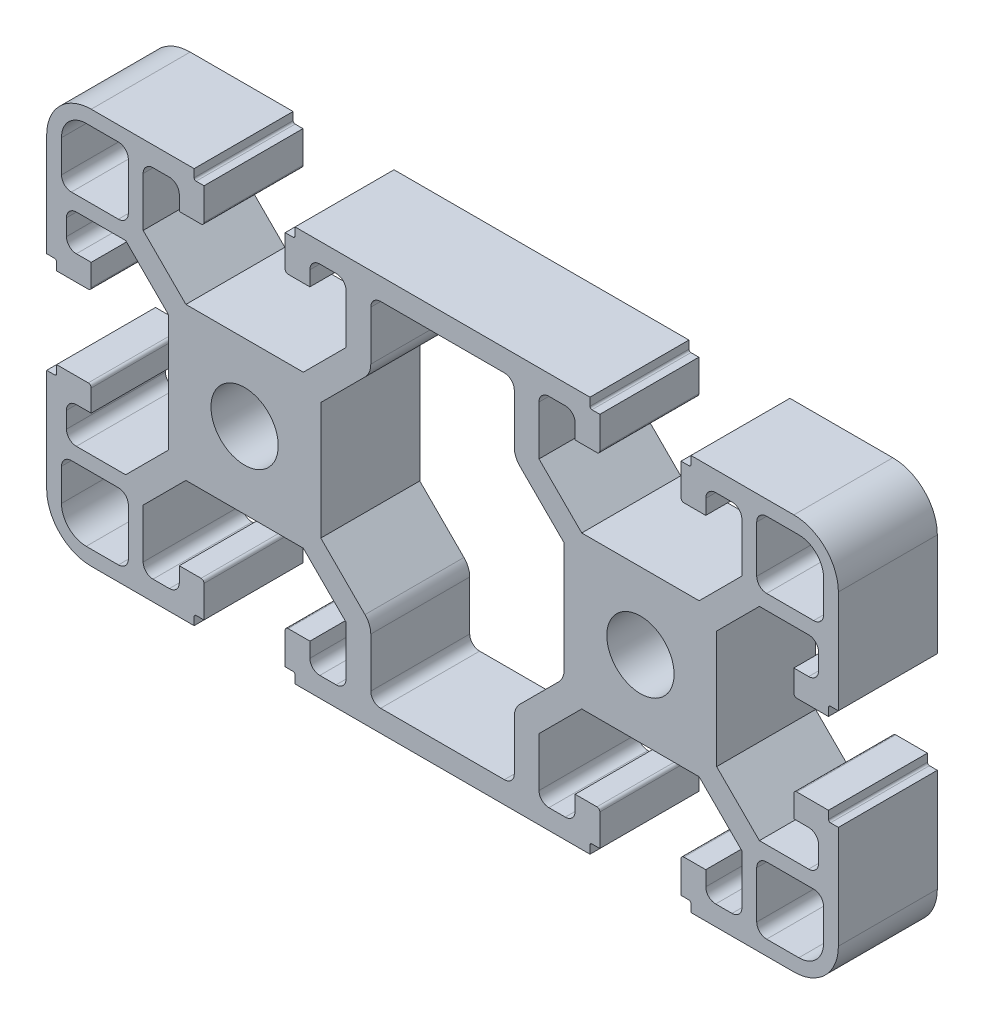
from build123d import *

# Parameters (mm, degrees)
SKETCH_1_R      = 3.4
EXTRUDE_1_DEPTH = 10


with BuildPart() as part:
    # 草图1 → 凸台-拉伸1 (new body)
    with BuildSketch(Plane.XY):
        with BuildLine():
            Line((-26.693625971, 19.851513067), (-37.093625971, 19.851513067))
            ThreePointArc((-37.093625971, 19.851513067), (-40.275606487, 18.533493583), (-41.593625971, 15.351513067))
            Line((-41.593625971, 15.351513067), (-41.593625971, 4.951513067))
            Line((-41.593625971, 4.951513067), (-40.793625971, 4.951513067))
            ThreePointArc((-40.793625971, 4.951513067), (-40.652204615, 4.892934424), (-40.593625971, 4.751513067))
            Line((-40.593625971, 4.751513067), (-40.593625971, 3.951513067))
            Line((-40.593625971, 3.951513067), (-37.393625971, 3.951513067))
            ThreePointArc((-37.393625971, 3.951513067), (-37.181493937, 4.039381033), (-37.093625971, 4.251513067))
            Line((-37.093625971, 4.251513067), (-37.093625971, 6.451513067))
            Line((-37.093625971, 6.451513067), (-38.593625971, 6.451513067))
            ThreePointArc((-38.593625971, 6.451513067), (-39.300732752, 6.744406286), (-39.593625971, 7.451513067))
            Line((-39.593625971, 7.451513067), (-39.593625971, 9.101513067))
            ThreePointArc((-39.593625971, 9.101513067), (-39.300732752, 9.808619849), (-38.593625971, 10.101513067))
            Line((-38.593625971, 10.101513067), (-33.611392924, 10.101513067))
            Line((-33.611392924, 10.101513067), (-29.293625971, 5.783746114))
            Line((-29.293625971, 5.783746114), (-29.293625971, -6.08071998))
            Line((-29.293625971, -6.08071998), (-33.611392924, -10.398486933))
            Line((-33.611392924, -10.398486933), (-38.593625971, -10.398486933))
            ThreePointArc((-38.593625971, -10.398486933), (-39.300732752, -10.105593714), (-39.593625971, -9.398486933))
            Line((-39.593625971, -9.398486933), (-39.593625971, -7.748486933))
            ThreePointArc((-39.593625971, -7.748486933), (-39.300732752, -7.041380151), (-38.593625971, -6.748486933))
            Line((-38.593625971, -6.748486933), (-37.093625971, -6.748486933))
            Line((-37.093625971, -6.748486933), (-37.093625971, -4.548486933))
            ThreePointArc((-37.093625971, -4.548486933), (-37.181493937, -4.336354898), (-37.393625971, -4.248486933))
            Line((-37.393625971, -4.248486933), (-40.593625971, -4.248486933))
            Line((-40.593625971, -4.248486933), (-40.593625971, -5.048486933))
            ThreePointArc((-40.593625971, -5.048486933), (-40.652204615, -5.189908289), (-40.793625971, -5.248486933))
            Line((-40.793625971, -5.248486933), (-41.593625971, -5.248486933))
            Line((-41.593625971, -5.248486933), (-41.593625971, -15.648486933))
            ThreePointArc((-41.593625971, -15.648486933), (-40.275606487, -18.830467448), (-37.093625971, -20.148486933))
            Line((-37.093625971, -20.148486933), (-26.693625971, -20.148486933))
            Line((-26.693625971, -20.148486933), (-26.693625971, -19.348486933))
            ThreePointArc((-26.693625971, -19.348486933), (-26.635047327, -19.207065576), (-26.493625971, -19.148486933))
            Line((-26.493625971, -19.148486933), (-25.693625971, -19.148486933))
            Line((-25.693625971, -19.148486933), (-25.693625971, -15.948486933))
            ThreePointArc((-25.693625971, -15.948486933), (-25.781493937, -15.736354898), (-25.993625971, -15.648486933))
            Line((-25.993625971, -15.648486933), (-28.193625971, -15.648486933))
            Line((-28.193625971, -15.648486933), (-28.193625971, -17.148486933))
            ThreePointArc((-28.193625971, -17.148486933), (-28.48651919, -17.855593714), (-29.193625971, -18.148486933))
            Line((-29.193625971, -18.148486933), (-30.843625971, -18.148486933))
            ThreePointArc((-30.843625971, -18.148486933), (-31.550732752, -17.855593714), (-31.843625971, -17.148486933))
            Line((-31.843625971, -17.148486933), (-31.843625971, -12.166253886))
            Line((-31.843625971, -12.166253886), (-27.525859018, -7.848486933))
            Line((-27.525859018, -7.848486933), (-15.661392924, -7.848486933))
            Line((-15.661392924, -7.848486933), (-11.343625971, -12.166253886))
            Line((-11.343625971, -12.166253886), (-11.343625971, -17.148486933))
            ThreePointArc((-11.343625971, -17.148486933), (-11.63651919, -17.855593714), (-12.343625971, -18.148486933))
            Line((-12.343625971, -18.148486933), (-13.993625971, -18.148486933))
            ThreePointArc((-13.993625971, -18.148486933), (-14.700732752, -17.855593714), (-14.993625971, -17.148486933))
            Line((-14.993625971, -17.148486933), (-14.993625971, -15.648486933))
            Line((-14.993625971, -15.648486933), (-17.193625971, -15.648486933))
            ThreePointArc((-17.193625971, -15.648486933), (-17.405758006, -15.736354898), (-17.493625971, -15.948486933))
            Line((-17.493625971, -15.948486933), (-17.493625971, -19.148486933))
            Line((-17.493625971, -19.148486933), (-16.693625971, -19.148486933))
            ThreePointArc((-16.693625971, -19.148486933), (-16.552204615, -19.207065576), (-16.493625971, -19.348486933))
            Line((-16.493625971, -19.348486933), (-16.493625971, -20.148486933))
            Line((-16.493625971, -20.148486933), (-6.093625971, -20.148486933))
            Line((-6.093625971, -20.148486933), (2.906374029, -20.148486933))
            Line((2.906374029, -20.148486933), (13.306374029, -20.148486933))
            Line((13.306374029, -20.148486933), (13.306374029, -19.348486933))
            ThreePointArc((13.306374029, -19.348486933), (13.364952673, -19.207065576), (13.506374029, -19.148486933))
            Line((13.506374029, -19.148486933), (14.306374029, -19.148486933))
            Line((14.306374029, -19.148486933), (14.306374029, -15.948486933))
            ThreePointArc((14.306374029, -15.948486933), (14.218506063, -15.736354898), (14.006374029, -15.648486933))
            Line((14.006374029, -15.648486933), (11.806374029, -15.648486933))
            Line((11.806374029, -15.648486933), (11.806374029, -17.148486933))
            ThreePointArc((11.806374029, -17.148486933), (11.51348081, -17.855593714), (10.806374029, -18.148486933))
            Line((10.806374029, -18.148486933), (9.156374029, -18.148486933))
            ThreePointArc((9.156374029, -18.148486933), (8.449267248, -17.855593714), (8.156374029, -17.148486933))
            Line((8.156374029, -17.148486933), (8.156374029, -12.166253886))
            Line((8.156374029, -12.166253886), (12.474140982, -7.848486933))
            Line((12.474140982, -7.848486933), (24.338607076, -7.848486933))
            Line((24.338607076, -7.848486933), (28.656374029, -12.166253886))
            Line((28.656374029, -12.166253886), (28.656374029, -17.148486933))
            ThreePointArc((28.656374029, -17.148486933), (28.36348081, -17.855593714), (27.656374029, -18.148486933))
            Line((27.656374029, -18.148486933), (26.006374029, -18.148486933))
            ThreePointArc((26.006374029, -18.148486933), (25.299267248, -17.855593714), (25.006374029, -17.148486933))
            Line((25.006374029, -17.148486933), (25.006374029, -15.648486933))
            Line((25.006374029, -15.648486933), (22.806374029, -15.648486933))
            ThreePointArc((22.806374029, -15.648486933), (22.594241994, -15.736354898), (22.506374029, -15.948486933))
            Line((22.506374029, -15.948486933), (22.506374029, -19.148486933))
            Line((22.506374029, -19.148486933), (23.306374029, -19.148486933))
            ThreePointArc((23.306374029, -19.148486933), (23.447795385, -19.207065576), (23.506374029, -19.348486933))
            Line((23.506374029, -19.348486933), (23.506374029, -20.148486933))
            Line((23.506374029, -20.148486933), (33.906374029, -20.148486933))
            ThreePointArc((33.906374029, -20.148486933), (37.088354544, -18.830467448), (38.406374029, -15.648486933))
            Line((38.406374029, -15.648486933), (38.406374029, -5.248486933))
            Line((38.406374029, -5.248486933), (37.606374029, -5.248486933))
            ThreePointArc((37.606374029, -5.248486933), (37.464952673, -5.189908289), (37.406374029, -5.048486933))
            Line((37.406374029, -5.048486933), (37.406374029, -4.248486933))
            Line((37.406374029, -4.248486933), (34.206374029, -4.248486933))
            ThreePointArc((34.206374029, -4.248486933), (33.994241994, -4.336354898), (33.906374029, -4.548486933))
            Line((33.906374029, -4.548486933), (33.906374029, -6.748486933))
            Line((33.906374029, -6.748486933), (35.406374029, -6.748486933))
            ThreePointArc((35.406374029, -6.748486933), (36.11348081, -7.041380151), (36.406374029, -7.748486933))
            Line((36.406374029, -7.748486933), (36.406374029, -9.398486933))
            ThreePointArc((36.406374029, -9.398486933), (36.11348081, -10.105593714), (35.406374029, -10.398486933))
            Line((35.406374029, -10.398486933), (30.424140982, -10.398486933))
            Line((30.424140982, -10.398486933), (26.106374029, -6.08071998))
            Line((26.106374029, -6.08071998), (26.106374029, 5.783746114))
            Line((26.106374029, 5.783746114), (30.424140982, 10.101513067))
            Line((30.424140982, 10.101513067), (35.406374029, 10.101513067))
            ThreePointArc((35.406374029, 10.101513067), (36.11348081, 9.808619849), (36.406374029, 9.101513067))
            Line((36.406374029, 9.101513067), (36.406374029, 7.451513067))
            ThreePointArc((36.406374029, 7.451513067), (36.11348081, 6.744406286), (35.406374029, 6.451513067))
            Line((35.406374029, 6.451513067), (33.906374029, 6.451513067))
            Line((33.906374029, 6.451513067), (33.906374029, 4.251513067))
            ThreePointArc((33.906374029, 4.251513067), (33.994241994, 4.039381033), (34.206374029, 3.951513067))
            Line((34.206374029, 3.951513067), (37.406374029, 3.951513067))
            Line((37.406374029, 3.951513067), (37.406374029, 4.751513067))
            ThreePointArc((37.406374029, 4.751513067), (37.464952673, 4.892934424), (37.606374029, 4.951513067))
            Line((37.606374029, 4.951513067), (38.406374029, 4.951513067))
            Line((38.406374029, 4.951513067), (38.406374029, 15.351513067))
            ThreePointArc((38.406374029, 15.351513067), (37.088354544, 18.533493583), (33.906374029, 19.851513067))
            Line((33.906374029, 19.851513067), (23.506374029, 19.851513067))
            Line((23.506374029, 19.851513067), (23.506374029, 19.051513067))
            ThreePointArc((23.506374029, 19.051513067), (23.447795385, 18.910091711), (23.306374029, 18.851513067))
            Line((23.306374029, 18.851513067), (22.506374029, 18.851513067))
            Line((22.506374029, 18.851513067), (22.506374029, 15.651513067))
            ThreePointArc((22.506374029, 15.651513067), (22.594241994, 15.439381033), (22.806374029, 15.351513067))
            Line((22.806374029, 15.351513067), (25.006374029, 15.351513067))
            Line((25.006374029, 15.351513067), (25.006374029, 16.851513067))
            ThreePointArc((25.006374029, 16.851513067), (25.299267248, 17.558619849), (26.006374029, 17.851513067))
            Line((26.006374029, 17.851513067), (27.656374029, 17.851513067))
            ThreePointArc((27.656374029, 17.851513067), (28.36348081, 17.558619849), (28.656374029, 16.851513067))
            Line((28.656374029, 16.851513067), (28.656374029, 11.86928002))
            Line((28.656374029, 11.86928002), (24.338607076, 7.551513067))
            Line((24.338607076, 7.551513067), (12.474140982, 7.551513067))
            Line((12.474140982, 7.551513067), (8.156374029, 11.86928002))
            Line((8.156374029, 11.86928002), (8.156374029, 16.851513067))
            ThreePointArc((8.156374029, 16.851513067), (8.449267248, 17.558619849), (9.156374029, 17.851513067))
            Line((9.156374029, 17.851513067), (10.806374029, 17.851513067))
            ThreePointArc((10.806374029, 17.851513067), (11.51348081, 17.558619849), (11.806374029, 16.851513067))
            Line((11.806374029, 16.851513067), (11.806374029, 15.351513067))
            Line((11.806374029, 15.351513067), (14.006374029, 15.351513067))
            ThreePointArc((14.006374029, 15.351513067), (14.218506063, 15.439381033), (14.306374029, 15.651513067))
            Line((14.306374029, 15.651513067), (14.306374029, 18.851513067))
            Line((14.306374029, 18.851513067), (13.506374029, 18.851513067))
            ThreePointArc((13.506374029, 18.851513067), (13.364952673, 18.910091711), (13.306374029, 19.051513067))
            Line((13.306374029, 19.051513067), (13.306374029, 19.851513067))
            Line((13.306374029, 19.851513067), (2.906374029, 19.851513067))
            Line((2.906374029, 19.851513067), (-6.093625971, 19.851513067))
            Line((-6.093625971, 19.851513067), (-16.493625971, 19.851513067))
            Line((-16.493625971, 19.851513067), (-16.493625971, 19.051513067))
            ThreePointArc((-16.493625971, 19.051513067), (-16.552204615, 18.910091711), (-16.693625971, 18.851513067))
            Line((-16.693625971, 18.851513067), (-17.493625971, 18.851513067))
            Line((-17.493625971, 18.851513067), (-17.493625971, 15.651513067))
            ThreePointArc((-17.493625971, 15.651513067), (-17.405758006, 15.439381033), (-17.193625971, 15.351513067))
            Line((-17.193625971, 15.351513067), (-14.993625971, 15.351513067))
            Line((-14.993625971, 15.351513067), (-14.993625971, 16.851513067))
            ThreePointArc((-14.993625971, 16.851513067), (-14.700732752, 17.558619849), (-13.993625971, 17.851513067))
            Line((-13.993625971, 17.851513067), (-12.343625971, 17.851513067))
            ThreePointArc((-12.343625971, 17.851513067), (-11.63651919, 17.558619849), (-11.343625971, 16.851513067))
            Line((-11.343625971, 16.851513067), (-11.343625971, 11.86928002))
            Line((-11.343625971, 11.86928002), (-15.661392924, 7.551513067))
            Line((-15.661392924, 7.551513067), (-27.525859018, 7.551513067))
            Line((-27.525859018, 7.551513067), (-31.843625971, 11.86928002))
            Line((-31.843625971, 11.86928002), (-31.843625971, 16.851513067))
            ThreePointArc((-31.843625971, 16.851513067), (-31.550732752, 17.558619849), (-30.843625971, 17.851513067))
            Line((-30.843625971, 17.851513067), (-29.193625971, 17.851513067))
            ThreePointArc((-29.193625971, 17.851513067), (-28.48651919, 17.558619849), (-28.193625971, 16.851513067))
            Line((-28.193625971, 16.851513067), (-28.193625971, 15.351513067))
            Line((-28.193625971, 15.351513067), (-25.993625971, 15.351513067))
            ThreePointArc((-25.993625971, 15.351513067), (-25.781493937, 15.439381033), (-25.693625971, 15.651513067))
            Line((-25.693625971, 15.651513067), (-25.693625971, 18.851513067))
            Line((-25.693625971, 18.851513067), (-26.493625971, 18.851513067))
            ThreePointArc((-26.493625971, 18.851513067), (-26.635047327, 18.910091711), (-26.693625971, 19.051513067))
            Line((-26.693625971, 19.051513067), (-26.693625971, 19.851513067))
        make_face()
        with Locations((-21.593625971, -0.148486933)):
            Circle(SKETCH_1_R, mode=Mode.SUBTRACT)
        with Locations((18.406374029, -0.148486933)):
            Circle(SKETCH_1_R, mode=Mode.SUBTRACT)
        with BuildLine():
            Line((-40.097625971, 15.855513067), (-40.097625971, 12.601513067))
            ThreePointArc((-40.097625971, 12.601513067), (-39.804732752, 11.894406286), (-39.097625971, 11.601513067))
            Line((-39.097625971, 11.601513067), (-34.343625971, 11.601513067))
            ThreePointArc((-34.343625971, 11.601513067), (-33.63651919, 11.894406286), (-33.343625971, 12.601513067))
            Line((-33.343625971, 12.601513067), (-33.343625971, 17.355513067))
            ThreePointArc((-33.343625971, 17.355513067), (-33.63651919, 18.062619849), (-34.343625971, 18.355513067))
            Line((-34.343625971, 18.355513067), (-37.597625971, 18.355513067))
            ThreePointArc((-37.597625971, 18.355513067), (-39.365392924, 17.62328002), (-40.097625971, 15.855513067))
        make_face(mode=Mode.SUBTRACT)
        with BuildLine():
            Line((-13.893625971, -6.08071998), (-13.893625971, 5.783746114))
            Line((-13.893625971, 5.783746114), (-9.429412409, 10.247959677))
            ThreePointArc((-9.429412409, 10.247959677), (-8.995866906, 10.896806374), (-8.843625971, 11.662173239))
            Line((-8.843625971, 11.662173239), (-8.843625971, 16.651513067))
            ThreePointArc((-8.843625971, 16.651513067), (-8.550732752, 17.358619849), (-7.843625971, 17.651513067))
            Line((-7.843625971, 17.651513067), (4.656374029, 17.651513067))
            ThreePointArc((4.656374029, 17.651513067), (5.36348081, 17.358619849), (5.656374029, 16.651513067))
            Line((5.656374029, 16.651513067), (5.656374029, 11.662173239))
            ThreePointArc((5.656374029, 11.662173239), (5.808614964, 10.896806374), (6.242160466, 10.247959677))
            Line((6.242160466, 10.247959677), (10.706374029, 5.783746114))
            Line((10.706374029, 5.783746114), (10.706374029, -5.252292855))
            ThreePointArc((10.706374029, -5.252292855), (10.554133094, -6.01765972), (10.120587591, -6.666506417))
            Line((10.120587591, -6.666506417), (6.242160466, -10.544933542))
            ThreePointArc((6.242160466, -10.544933542), (5.808614964, -11.19378024), (5.656374029, -11.959147104))
            Line((5.656374029, -11.959147104), (5.656374029, -16.948486933))
            ThreePointArc((5.656374029, -16.948486933), (5.36348081, -17.655593714), (4.656374029, -17.948486933))
            Line((4.656374029, -17.948486933), (-7.843625971, -17.948486933))
            ThreePointArc((-7.843625971, -17.948486933), (-8.550732752, -17.655593714), (-8.843625971, -16.948486933))
            Line((-8.843625971, -16.948486933), (-8.843625971, -11.959147104))
            ThreePointArc((-8.843625971, -11.959147104), (-8.995866906, -11.19378024), (-9.429412409, -10.544933542))
            Line((-9.429412409, -10.544933542), (-13.893625971, -6.08071998))
        make_face(mode=Mode.SUBTRACT)
        with BuildLine():
            Line((-40.097625971, -16.152486933), (-40.097625971, -12.898486933))
            ThreePointArc((-40.097625971, -12.898486933), (-39.804732752, -12.191380151), (-39.097625971, -11.898486933))
            Line((-39.097625971, -11.898486933), (-34.343625971, -11.898486933))
            ThreePointArc((-34.343625971, -11.898486933), (-33.63651919, -12.191380151), (-33.343625971, -12.898486933))
            Line((-33.343625971, -12.898486933), (-33.343625971, -17.652486933))
            ThreePointArc((-33.343625971, -17.652486933), (-33.63651919, -18.359593714), (-34.343625971, -18.652486933))
            Line((-34.343625971, -18.652486933), (-37.597625971, -18.652486933))
            ThreePointArc((-37.597625971, -18.652486933), (-39.365392924, -17.920253886), (-40.097625971, -16.152486933))
        make_face(mode=Mode.SUBTRACT)
        with BuildLine():
            Line((36.910374029, 15.855513067), (36.910374029, 12.601513067))
            ThreePointArc((36.910374029, 12.601513067), (36.61748081, 11.894406286), (35.910374029, 11.601513067))
            Line((35.910374029, 11.601513067), (31.156374029, 11.601513067))
            ThreePointArc((31.156374029, 11.601513067), (30.449267248, 11.894406286), (30.156374029, 12.601513067))
            Line((30.156374029, 12.601513067), (30.156374029, 17.355513067))
            ThreePointArc((30.156374029, 17.355513067), (30.449267248, 18.062619849), (31.156374029, 18.355513067))
            Line((31.156374029, 18.355513067), (34.410374029, 18.355513067))
            ThreePointArc((34.410374029, 18.355513067), (36.178140982, 17.62328002), (36.910374029, 15.855513067))
        make_face(mode=Mode.SUBTRACT)
        with BuildLine():
            Line((36.910374029, -16.152486933), (36.910374029, -12.898486933))
            ThreePointArc((36.910374029, -12.898486933), (36.61748081, -12.191380151), (35.910374029, -11.898486933))
            Line((35.910374029, -11.898486933), (31.156374029, -11.898486933))
            ThreePointArc((31.156374029, -11.898486933), (30.449267248, -12.191380151), (30.156374029, -12.898486933))
            Line((30.156374029, -12.898486933), (30.156374029, -17.652486933))
            ThreePointArc((30.156374029, -17.652486933), (30.449267248, -18.359593714), (31.156374029, -18.652486933))
            Line((31.156374029, -18.652486933), (34.410374029, -18.652486933))
            ThreePointArc((34.410374029, -18.652486933), (36.178140982, -17.920253886), (36.910374029, -16.152486933))
        make_face(mode=Mode.SUBTRACT)
    extrude(amount=EXTRUDE_1_DEPTH)


solid = part.part
